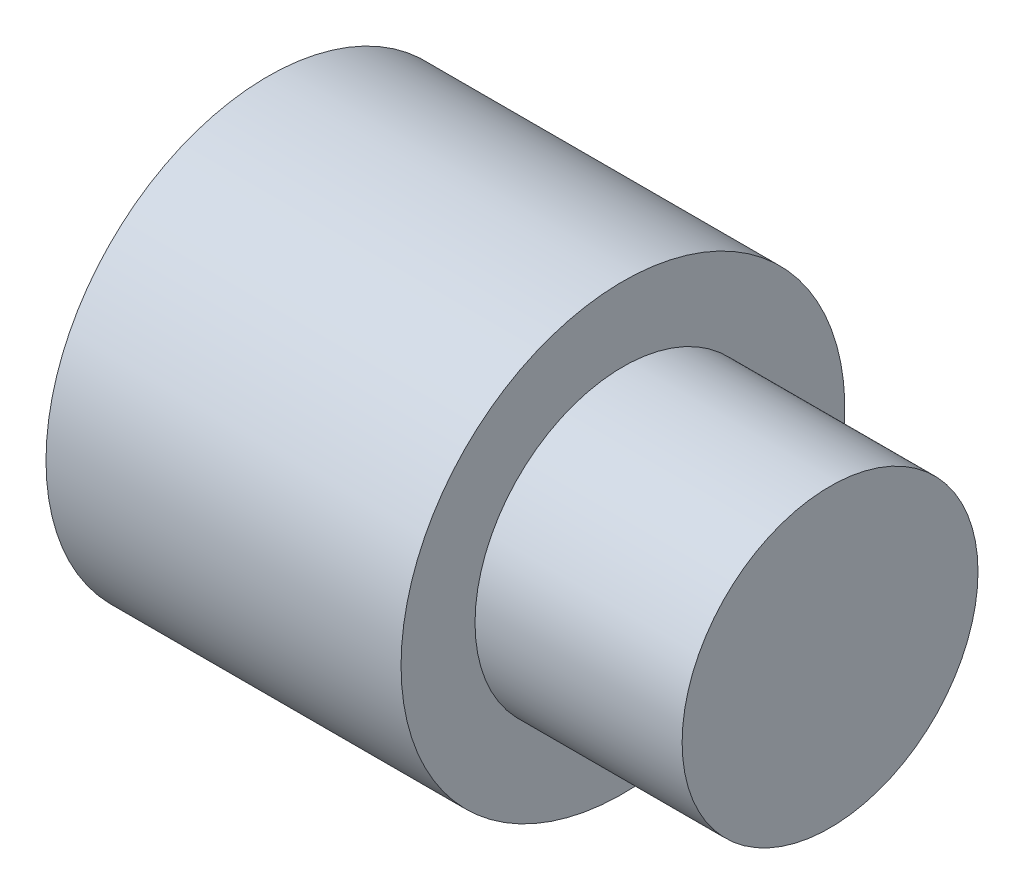
from build123d import *

# Parameters (mm, degrees)
SOCKET_1_SKETCH_W = 11.5
SOCKET_1_SKETCH_H = 4.953


with BuildPart() as part:
    # Reg_Outlet_Upper Sketch → Reg_Outlet_Upper (revolve)
    with BuildSketch(Plane.XY):
        Polygon((14, 0), (14, 10), (0, 10), (0, 15), (-24, 15), (-24, 0), align=None)
    revolve(axis=Axis((-1000, 0, 0), (1, 0, 0)))

    # Socket 1 Sketch → Socket 1 (revolve, cut)
    with BuildSketch(Plane.XY):
        with Locations((-19.25, 2.4765)):
            Rectangle(SOCKET_1_SKETCH_W, SOCKET_1_SKETCH_H)
    revolve(axis=Axis((-1000, 0, 0), (1, 0, 0)), mode=Mode.SUBTRACT)


solid = part.part
